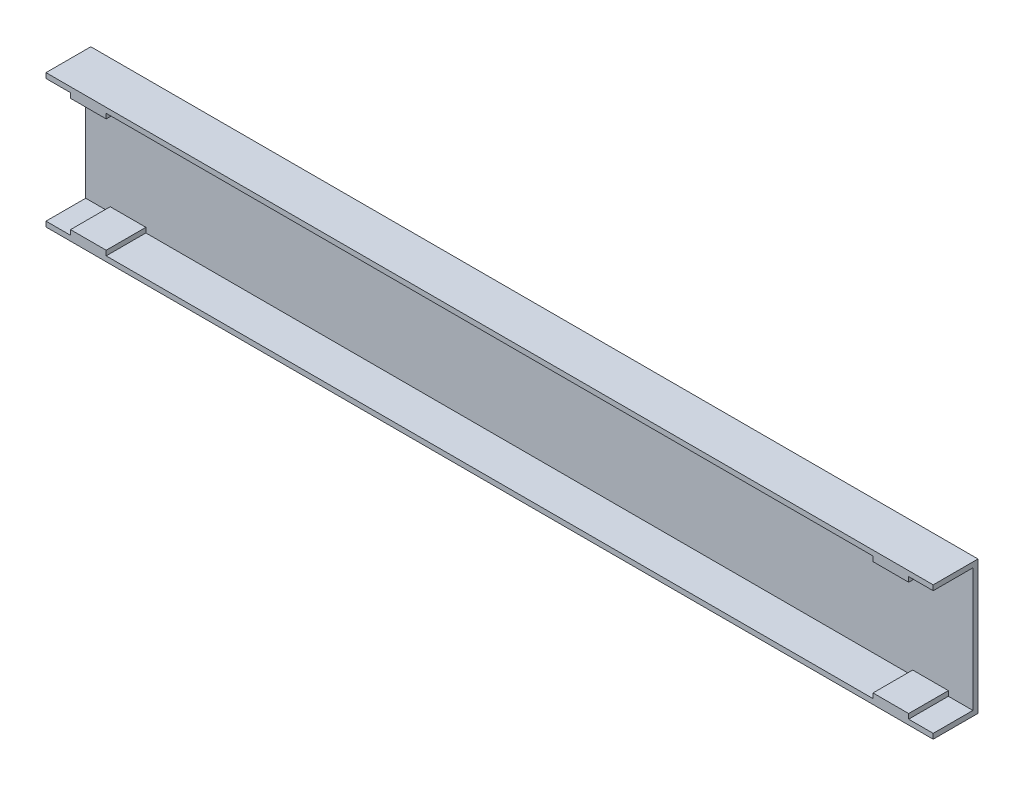
from build123d import *

# Parameters (mm, degrees)
SKETCH_1_W        = 1990
SKETCH_1_H        = 300
EXTRUDE_450_DEPTH = 11.5
EXTRUDE_1_DEPTH   = 89
SKETCH_7_W        = 70
SKETCH_7_H        = 230
SKETCH_7_R        = 13
EXTRUDE_2_DEPTH   = 16


with BuildPart() as part:
    # 草图1 → Extrude 450 (new body)
    with BuildSketch(Plane.XY):
        with Locations((0, 150)):
            Rectangle(SKETCH_1_W, SKETCH_1_H)
    extrude(amount=EXTRUDE_450_DEPTH)

    # 草图2 → 凸台-拉伸1 (add)
    with BuildSketch(Plane.XY.offset(11.5)):
        Polygon((-995, 300), (995, 300), (995, 288.5), (940, 288.5), (940, 277.5), (860, 277.5), (860, 288.5), (-860, 288.5), (-860, 277.5), (-940, 277.5), (-940, 288.5), (-995, 288.5), align=None)
        Polygon((-995, 0), (995, 0), (995, 11.5), (940, 11.5), (940, 22.5), (860, 22.5), (860, 11.5), (-860, 11.5), (-860, 22.5), (-940, 22.5), (-940, 11.5), (-995, 11.5), align=None)
    extrude(amount=EXTRUDE_1_DEPTH)

    # 草图7 → 凸台-拉伸2 (add)
    # profile 1 of 2: a face of its own
    with BuildSketch(Plane(origin=(0, 0, 0), x_dir=(-1, 0, 0), z_dir=(0, 0, -1))):
        with Locations((300, 150)):
            Rectangle(SKETCH_7_W, SKETCH_7_H)
        with Locations((300, 230)):
            Circle(SKETCH_7_R, mode=Mode.SUBTRACT)
        with Locations((300, 150)):
            Circle(SKETCH_7_R, mode=Mode.SUBTRACT)
        with Locations((300, 70)):
            Circle(SKETCH_7_R, mode=Mode.SUBTRACT)
    # profile 2 of 2: a face of its own
    with BuildSketch(Plane(origin=(0, 0, 0), x_dir=(-1, 0, 0), z_dir=(0, 0, -1))):
        with Locations((-300, 150)):
            Rectangle(SKETCH_7_W, SKETCH_7_H)
        with Locations(Location((-300, 70, 0), (0, 0, 180))):
            Circle(SKETCH_7_R, mode=Mode.SUBTRACT)
        with Locations(Location((-300, 150, 0), (0, 0, 180))):
            Circle(SKETCH_7_R, mode=Mode.SUBTRACT)
        with Locations(Location((-300, 230, 0), (0, 0, 180))):
            Circle(SKETCH_7_R, mode=Mode.SUBTRACT)
    extrude(amount=EXTRUDE_2_DEPTH)


solid = part.part
